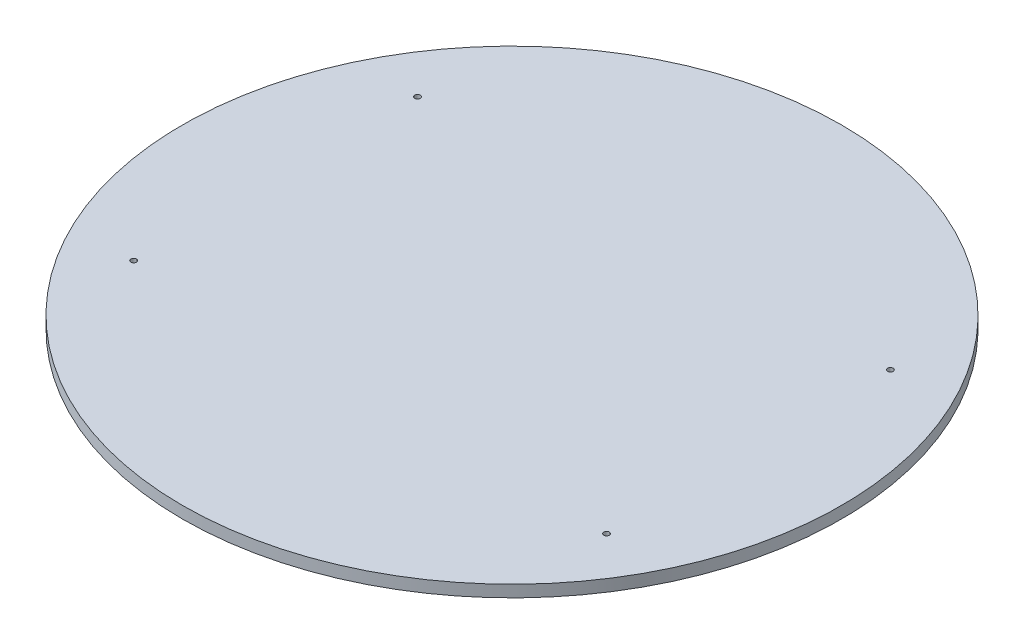
from build123d import *

# Parameters (mm, degrees)
SKETCH1_R           = 177
SKETCH1_R_2         = 1.5
BOSS_EXTRUDE1_DEPTH = 6.35


with BuildPart() as part:
    # Sketch1 → Boss-Extrude1 (new body)
    with BuildSketch(Plane(origin=(0, 0, 0), x_dir=(1, 0, 0), z_dir=(0, 1, 0))):
        with Locations(Location((0, 0, 0), (0, 0, 270))):
            Circle(SKETCH1_R)
        with Locations(Location((-127, -76.2, 0), (0, 0, 270))):
            Circle(SKETCH1_R_2, mode=Mode.SUBTRACT)
        with Locations(Location((-127, 76.2, 0), (0, 0, 270))):
            Circle(SKETCH1_R_2, mode=Mode.SUBTRACT)
        with Locations(Location((127, 76.2, 0), (0, 0, 270))):
            Circle(SKETCH1_R_2, mode=Mode.SUBTRACT)
        with Locations(Location((127, -76.2, 0), (0, 0, 270))):
            Circle(SKETCH1_R_2, mode=Mode.SUBTRACT)
    extrude(amount=BOSS_EXTRUDE1_DEPTH)


solid = part.part
